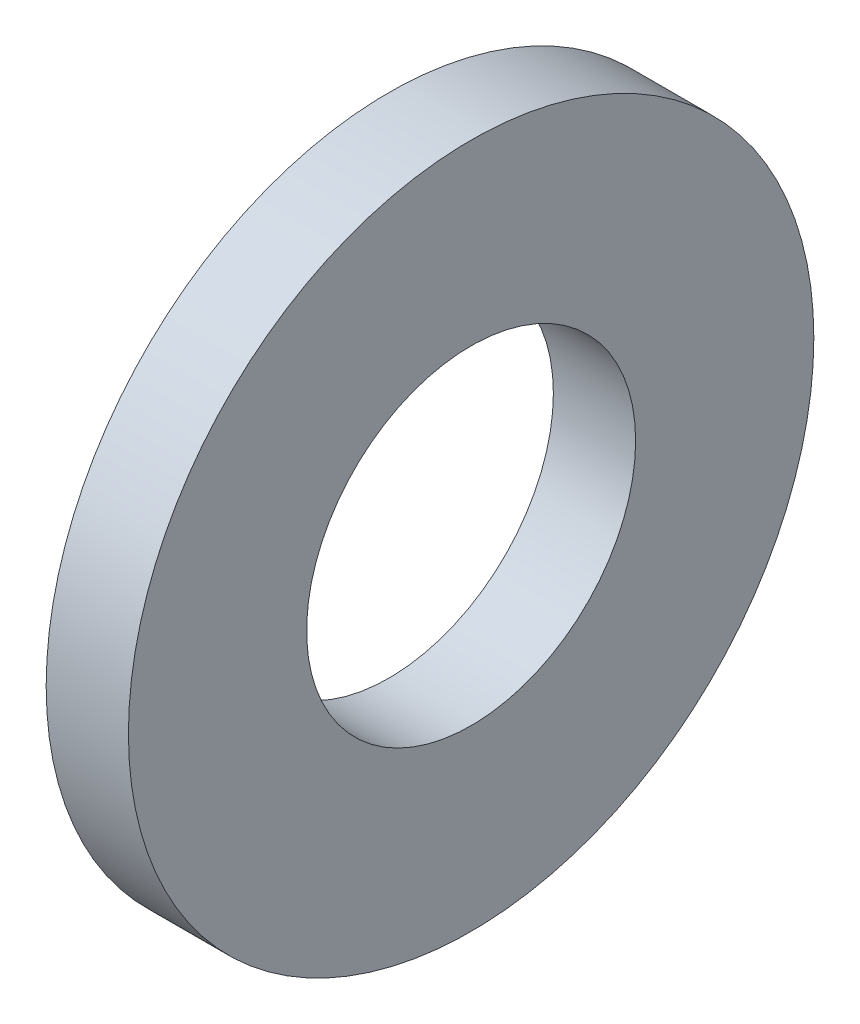
from build123d import *

# Parameters (mm, degrees)
SKETCH1_R           = 12.5
SKETCH1_R_2         = 6
BOSS_EXTRUDE1_DEPTH = 3


with BuildPart() as part:
    # Sketch1 → Boss-Extrude1 (new body)
    with BuildSketch(Plane(origin=(0, 0, 0), x_dir=(0, 0, -1), z_dir=(1, 0, 0))):
        Circle(SKETCH1_R)
        Circle(SKETCH1_R_2, mode=Mode.SUBTRACT)
    extrude(amount=BOSS_EXTRUDE1_DEPTH)


solid = part.part
